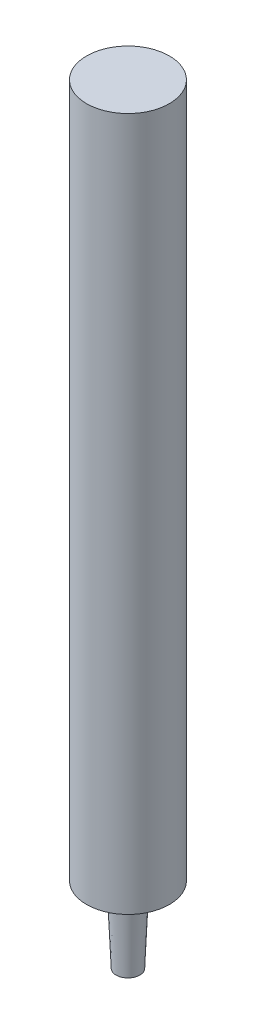
from build123d import *

# Parameters (mm, degrees)
SCALE1_SCALE_X = 1.05
SCALE1_SCALE_Y = 1.01
SCALE1_SCALE_Z = 1.05


with BuildPart() as part:
    # Sketch2 → Revolve1 (revolve)
    with BuildSketch(Plane.XY):
        Polygon((0, 60.5), (0, -60.5), (2.7, -60.5), (3.275, -46.35), (9.44, -42.5), (9.44, 60.5), (9.44, 122), (0, 122), align=None)
    revolve(axis=Axis((0, 60.5, 0), (0, -1, 0)))


with BuildPart() as part_1:
    # Scale1: scaled about (0, 0, 0)
    add(part.part.scale((SCALE1_SCALE_X, SCALE1_SCALE_Y, SCALE1_SCALE_Z), about=(0, 0, 0)))


solid = part_1.part
